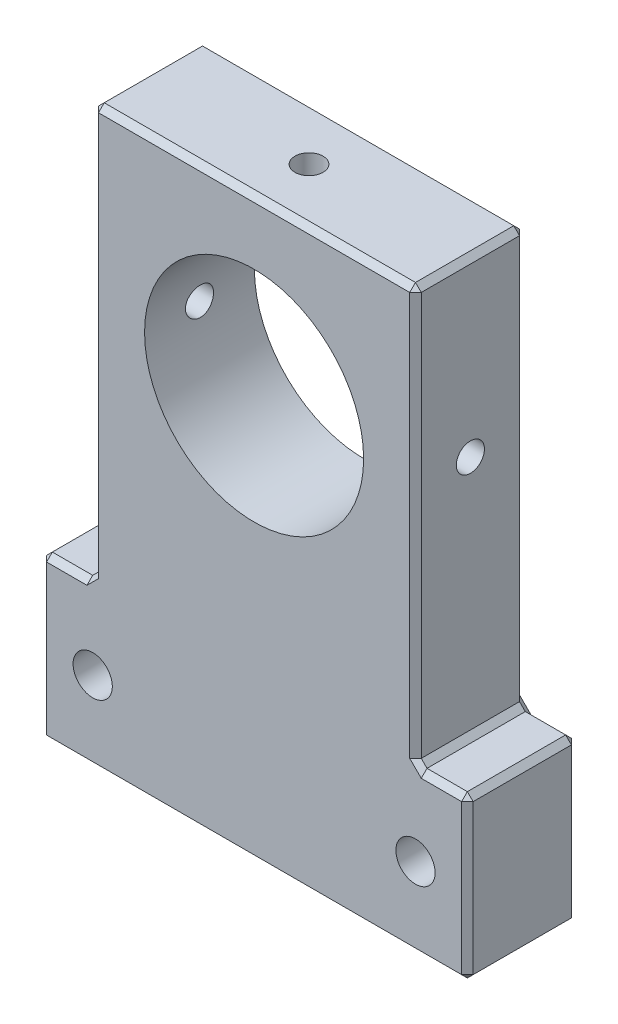
from build123d import *

# Parameters (mm, degrees)
SKETCH1_R               = 9.5
SKETCH1_R_2             = 1.7
BOSS_EXTRUDE1_DEPTH     = 9.525
SKETCH2_R               = 3.25
CUT_EXTRUDE1_DEPTH      = 5.5
SKETCH3_R               = 1.2195
CUT_EXTRUDE2_DEPTH      = 61.390194775
CUT_EXTRUDE3_REACH      = 64.926
CUT_EXTRUDE3_END_RADIUS = 9.5
SKETCH4_R               = 1.2195
CHAMFER1_SIZE           = 0.5


with BuildPart() as part:
    # Sketch1 → Boss-Extrude1 (new body)
    with BuildSketch(Plane(origin=(0, 0, 0), x_dir=(-1, 0, 0), z_dir=(0, 0, 1))):
        Polygon((-37, 0), (-37, -14), (-32.5, -14), (-32.5, -50), (-4.5, -50), (-4.5, -14), (0, -14), (0, 0), align=None)
        with Locations((-18.5, -35)):
            Circle(SKETCH1_R, mode=Mode.SUBTRACT)
        with Locations((-32.5, -7)):
            Circle(SKETCH1_R_2, mode=Mode.SUBTRACT)
        with Locations((-4.5, -7)):
            Circle(SKETCH1_R_2, mode=Mode.SUBTRACT)
    extrude(amount=BOSS_EXTRUDE1_DEPTH)

    # Sketch2 → Cut-Extrude1 (cut)
    with BuildSketch(Plane(origin=(0, 0, 0), x_dir=(-1, 0, 0), z_dir=(0, 0, -1))):
        with Locations((-32.5, 7)):
            Circle(SKETCH2_R)
        with Locations((-4.5, 7)):
            Circle(SKETCH2_R)
    extrude(amount=-CUT_EXTRUDE1_DEPTH, mode=Mode.SUBTRACT)

    # Sketch3 → Cut-Extrude2 (cut, through all)
    with BuildSketch(Plane.ZY.offset(-4.5)):
        with Locations(Location((4.7625, 35, 0), (0, 0, 270))):
            Circle(SKETCH3_R)
    extrude(amount=-CUT_EXTRUDE2_DEPTH, mode=Mode.SUBTRACT)

    # Cut-Extrude3: up to this cylinder (the profile starts outside it)
    cut_extrude3_end = Plane(origin=(18.5, 35, 4.7625), z_dir=(0, 0, -1)) * Cylinder(CUT_EXTRUDE3_END_RADIUS, 149.852, mode=Mode.PRIVATE)
    # Sketch4 → Cut-Extrude3 (cut, up to the surface)
    with BuildSketch(Plane(origin=(0, 50, 0), x_dir=(1, 0, 0), z_dir=(0, 1, 0)), mode=Mode.PRIVATE) as cut_extrude3_sk1:
        with Locations(Location((18.5, -4.7625, 0), (0, 0, 270))):
            Circle(SKETCH4_R)
    cut_extrude3_tool1 = extrude(cut_extrude3_sk1.sketch, amount=-CUT_EXTRUDE3_REACH, mode=Mode.PRIVATE) - cut_extrude3_end
    add(cut_extrude3_tool1.solids().sort_by_distance((18.5, 50, 4.7625))[0], mode=Mode.SUBTRACT)

    # Chamfer1
    chamfer1_edges = [part.edges().sort_by_distance(p)[0] for p in [
        (18.5, 50, 0),
        (32.5, 32, 0),
        (34.75, 14, 0),
        (37, 7, 0),
        (18.5, 0, 0),
        (0, 7, 0),
        (2.25, 14, 0),
        (4.5, 32, 0),
        (4.5, 32, 9.525),
        (4.5, 50, 4.7625),
        (32.5, 50, 4.7625),
        (32.5, 14, 4.7625),
        (37, 14, 4.7625),
        (37, 0, 4.7625),
        (0, 0, 4.7625),
        (0, 14, 4.7625),
        (4.5, 14, 4.7625),
        (2.25, 14, 9.525),
        (0, 7, 9.525),
        (18.5, 0, 9.525),
        (37, 7, 9.525),
        (35.75, 7, 0),
        (34.75, 14, 9.525),
        (7.75, 7, 0),
        (32.5, 32, 9.525),
        (18.5, 50, 9.525),
    ]]
    chamfer(chamfer1_edges, length=CHAMFER1_SIZE)


solid = part.part
